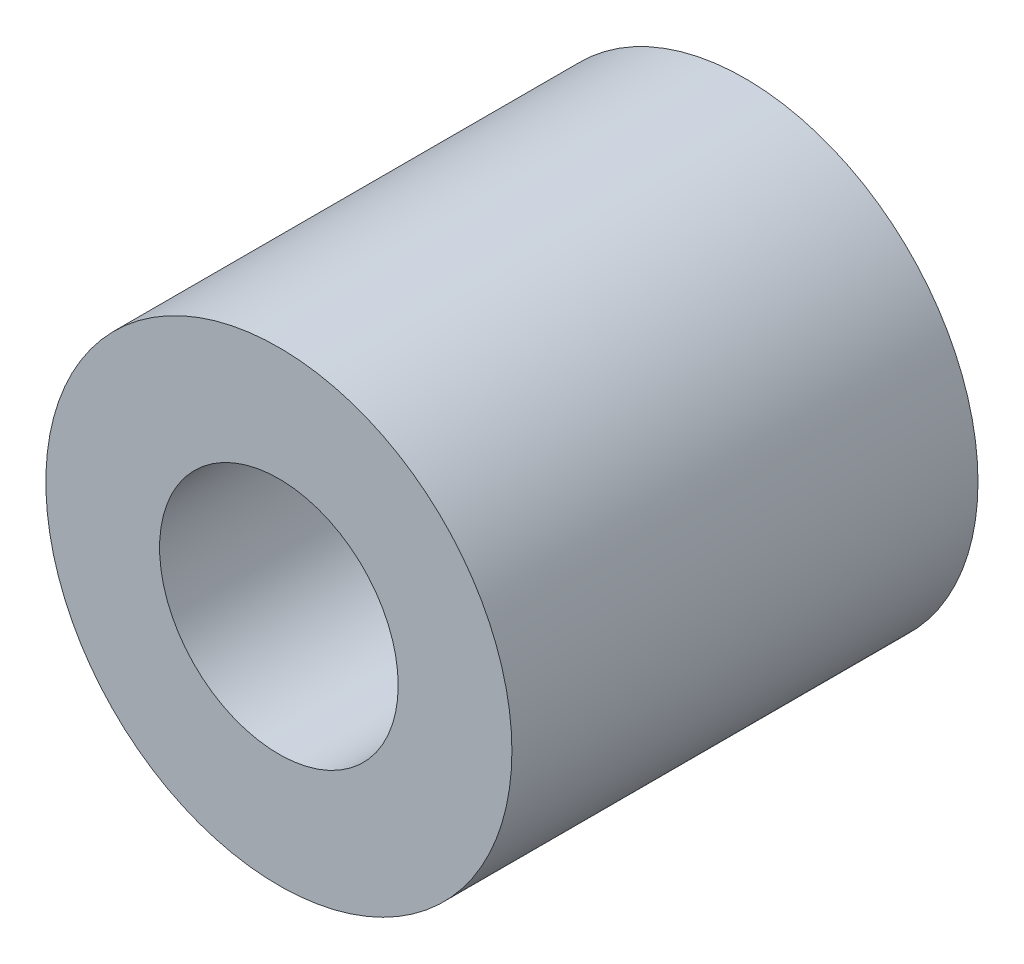
from build123d import *

# Parameters (mm, degrees)
SKETCH1_R      = 1.5875
SKETCH1_R_2    = 0.8128
EXTRUDE1_DEPTH = 1.5875


with BuildPart() as part:
    # Sketch1 → Extrude1 (new, symmetric)
    with BuildSketch(Plane.XY):
        Circle(SKETCH1_R)
        Circle(SKETCH1_R_2, mode=Mode.SUBTRACT)
    extrude(amount=EXTRUDE1_DEPTH, both=True)


solid = part.part
